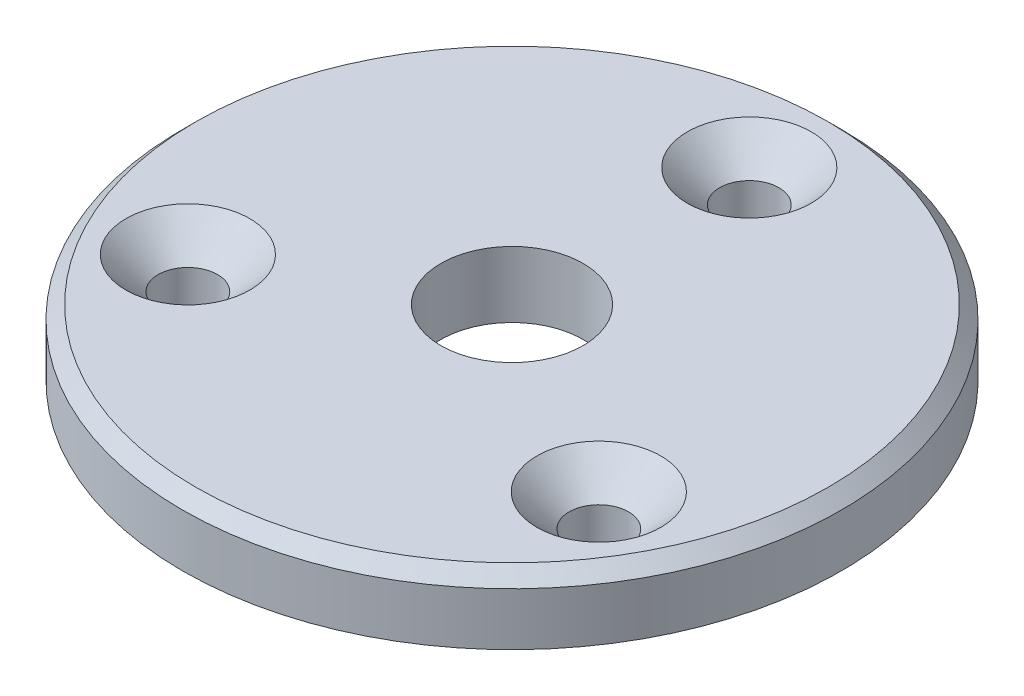
from build123d import *

# Parameters (mm, degrees)
SKETCH1_R                                     = 25
BOSS_EXTRUDE1_DEPTH                           = 5
CHAMFER1_SIZE                                 = 1
CSK_FOR_M4_COUNTERSUNK_FLAT_HEAD1_D           = 4.5
CSK_FOR_M4_COUNTERSUNK_FLAT_HEAD1_CSINK_D     = 9.4
CSK_FOR_M4_COUNTERSUNK_FLAT_HEAD1_CSINK_ANGLE = 90
M12X1_25_TAPPED_HOLE1_D                       = 10.8
M12X1_25_TAPPED_HOLE1_ON_FACE_2_D             = 10.8
CIRPATTERN1_COUNT                             = 3


with BuildPart() as part:
    # Sketch1 → Boss-Extrude1 (new body)
    with BuildSketch(Plane(origin=(0, 0, 0), x_dir=(1, 0, 0), z_dir=(0, 1, 0))):
        with Locations(Location((0, 0, 0), (0, 0, 270))):
            Circle(SKETCH1_R)
    extrude(amount=BOSS_EXTRUDE1_DEPTH)

    # Chamfer1
    chamfer1_edges = [part.edges().sort_by_distance(p)[0] for p in [
        (0, 5, -25),
    ]]
    chamfer(chamfer1_edges, length=CHAMFER1_SIZE)

    # CSK for M4 Countersunk Flat Head1 (through all)
    with Locations(Plane(origin=(0, 5, -18), x_dir=(0, 0, 1), z_dir=(0, 1, 0))):
        with Locations((0, 0)):
            csk_for_m4_countersunk_flat_head1 = CounterSinkHole(CSK_FOR_M4_COUNTERSUNK_FLAT_HEAD1_D / 2, CSK_FOR_M4_COUNTERSUNK_FLAT_HEAD1_CSINK_D / 2, counter_sink_angle=CSK_FOR_M4_COUNTERSUNK_FLAT_HEAD1_CSINK_ANGLE)

    # M12x1.25 Tapped Hole1 (through all)
    with Locations(Plane(origin=(0, 0, 0), x_dir=(0, 0, -1), z_dir=(0, -1, 0))):
        with Locations((0, 0)):
            Hole(M12X1_25_TAPPED_HOLE1_D / 2)

    # M12x1.25 Tapped Hole1 on face 2 (through all)
    with Locations(Plane.ZX.offset(5)):
        with Locations((0, 0)):
            Hole(M12X1_25_TAPPED_HOLE1_ON_FACE_2_D / 2)

    # CirPattern1: CSK for M4 Countersunk Flat Head1 ×3 about axis
    cirpattern1_axis = Axis((0, 0, 0), (0, 1, 0))
    for i in range(1, CIRPATTERN1_COUNT):
        add(csk_for_m4_countersunk_flat_head1.rotate(cirpattern1_axis, i * 360 / CIRPATTERN1_COUNT), mode=Mode.SUBTRACT)


solid = part.part
